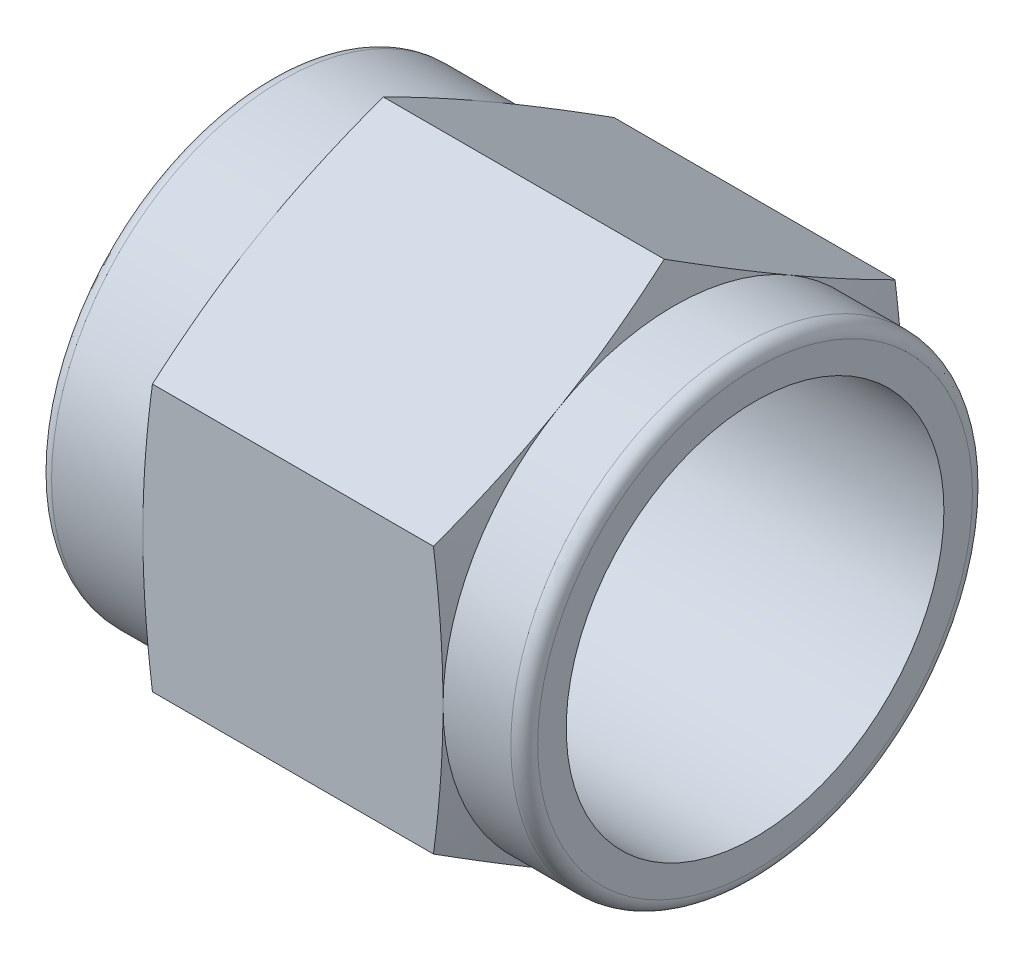
from build123d import *

# Parameters (mm, degrees)
BOSS_EXTRUDE1_DEPTH      = 9.1948
BOSS_EXTRUDE1_DEPTH_BACK = 9.1948
SKETCH3_R                = 5.588
SKETCH4_OUTSIDE_W        = 25.942
SKETCH4_OUTSIDE_H        = 28.644
SKETCH4_OUTSIDE_R        = 8.73125
CUT_EXTRUDE1_DEPTH       = 3.9624
SKETCH5_OUTSIDE_W        = 25.942
SKETCH5_OUTSIDE_H        = 28.644
SKETCH5_OUTSIDE_R        = 8.73125
CUT_EXTRUDE2_DEPTH       = 3.0734
SKETCH6_OUTSIDE_W        = 180.058
SKETCH6_OUTSIDE_H        = 182.76
SKETCH6_OUTSIDE_R        = 8.73125
CUT_EXTRUDE3_DEPTH       = 20.647522197
CUT_EXTRUDE3_DRAFT       = -75
SKETCH7_OUTSIDE_W        = 184.996
SKETCH7_OUTSIDE_H        = 187.698
SKETCH7_OUTSIDE_R        = 8.73125
CUT_EXTRUDE4_DEPTH       = 21.309283864
CUT_EXTRUDE4_DRAFT       = -75
SKETCH8_R                = 7.14375
CUT_EXTRUDE5_DEPTH       = 14.4272
CHAMFER1_SIZE            = 0.381
FILLET1_R                = 0.508


with BuildPart() as part:
    # Sketch3 → Boss-Extrude1 (new, two sides: drawn at the far end of the back side and taken through both)
    with BuildSketch(Plane(origin=(0, 0, 0), x_dir=(0, 0, -1), z_dir=(1, 0, 0)).offset(-BOSS_EXTRUDE1_DEPTH_BACK)):
        Polygon((8.73125, 5.040989538), (0, 10.081979076), (-8.73125, 5.040989538), (-8.73125, -5.040989538), (0, -10.081979076), (8.73125, -5.040989538), align=None)
        Circle(SKETCH3_R, mode=Mode.SUBTRACT)
    extrude(amount=BOSS_EXTRUDE1_DEPTH + BOSS_EXTRUDE1_DEPTH_BACK)

    # Sketch4 outside → Cut-Extrude1 (cut)
    with BuildSketch(Plane.ZY.offset(9.1948)):
        Rectangle(SKETCH4_OUTSIDE_W, SKETCH4_OUTSIDE_H)
        with Locations(Location((0, 0, 0), (0, 0, 180))):
            Circle(SKETCH4_OUTSIDE_R, mode=Mode.SUBTRACT)
    extrude(amount=-CUT_EXTRUDE1_DEPTH, mode=Mode.SUBTRACT)

    # Sketch5 outside → Cut-Extrude2 (cut)
    with BuildSketch(Plane(origin=(9.1948, 0, 0), x_dir=(0, 0, -1), z_dir=(1, 0, 0))):
        Rectangle(SKETCH5_OUTSIDE_W, SKETCH5_OUTSIDE_H)
        Circle(SKETCH5_OUTSIDE_R, mode=Mode.SUBTRACT)
    extrude(amount=-CUT_EXTRUDE2_DEPTH, mode=Mode.SUBTRACT)


with BuildPart() as cut_extrude3_tool:
    # Sketch6 outside → Cut-Extrude3 (with draft: the straight prism first)
    with BuildSketch(Plane.ZY.offset(5.2324)):
        Rectangle(SKETCH6_OUTSIDE_W, SKETCH6_OUTSIDE_H)
        with Locations(Location((0, 0, 0), (0, 0, 180))):
            Circle(SKETCH6_OUTSIDE_R, mode=Mode.SUBTRACT)
    extrude(amount=-CUT_EXTRUDE3_DEPTH)
    # Cut-Extrude3: the draft: its side faces are tilted about the plane it starts from
    cut_extrude3_sides = [cut_extrude3_tool.faces().sort_by_distance(p)[0] for p in [
        (5.091361099, -91.38, 0),
        (5.091361099, 0, 90.029),
        (5.091361099, 91.38, 0),
        (5.091361099, 0, -90.029),
        (5.091361099, 0, 8.73125),
    ]]
    draft(cut_extrude3_sides, Plane.ZY.offset(5.2324), CUT_EXTRUDE3_DRAFT)


with BuildPart() as part_1:
    add(part.part)

    # Cut-Extrude3: cut by cut_extrude3_tool
    add(cut_extrude3_tool.part, mode=Mode.SUBTRACT)


with BuildPart() as cut_extrude4_tool:
    # Sketch7 outside → Cut-Extrude4 (with draft: the straight prism first)
    with BuildSketch(Plane(origin=(6.1214, 0, 0), x_dir=(0, 0, -1), z_dir=(1, 0, 0))):
        Rectangle(SKETCH7_OUTSIDE_W, SKETCH7_OUTSIDE_H)
        Circle(SKETCH7_OUTSIDE_R, mode=Mode.SUBTRACT)
    extrude(amount=-CUT_EXTRUDE4_DEPTH)
    # Cut-Extrude4: the draft: its side faces are tilted about the plane it starts from
    cut_extrude4_sides = [cut_extrude4_tool.faces().sort_by_distance(p)[0] for p in [
        (-4.533241932, -93.849, 0),
        (-4.533241932, 0, -92.498),
        (-4.533241932, 93.849, 0),
        (-4.533241932, 0, 92.498),
        (-4.533241932, 0, 8.73125),
    ]]
    draft(cut_extrude4_sides, Plane(origin=(6.1214, 0, 0), x_dir=(0, 0, -1), z_dir=(1, 0, 0)), CUT_EXTRUDE4_DRAFT)


with BuildPart() as part_2:
    add(part_1.part)

    # Cut-Extrude4: cut by cut_extrude4_tool
    add(cut_extrude4_tool.part, mode=Mode.SUBTRACT)

    # Sketch8 → Cut-Extrude5 (cut)
    with BuildSketch(Plane(origin=(9.1948, 0, 0), x_dir=(0, 0, -1), z_dir=(1, 0, 0))):
        Circle(SKETCH8_R)
    extrude(amount=-CUT_EXTRUDE5_DEPTH, mode=Mode.SUBTRACT)

    # Chamfer1
    chamfer1_edges = [part_2.edges().sort_by_distance(p)[0] for p in [
        (-9.1948, 0, 5.588),
        (-5.2324, 0, 5.588),
    ]]
    chamfer(chamfer1_edges, length=CHAMFER1_SIZE)

    # Fillet1
    fillet1_edges = [part_2.edges().sort_by_distance(p)[0] for p in [
        (-9.1948, 0, 8.73125),
        (9.1948, 0, 8.73125),
    ]]
    fillet(fillet1_edges, radius=FILLET1_R)


solid = part_2.part
